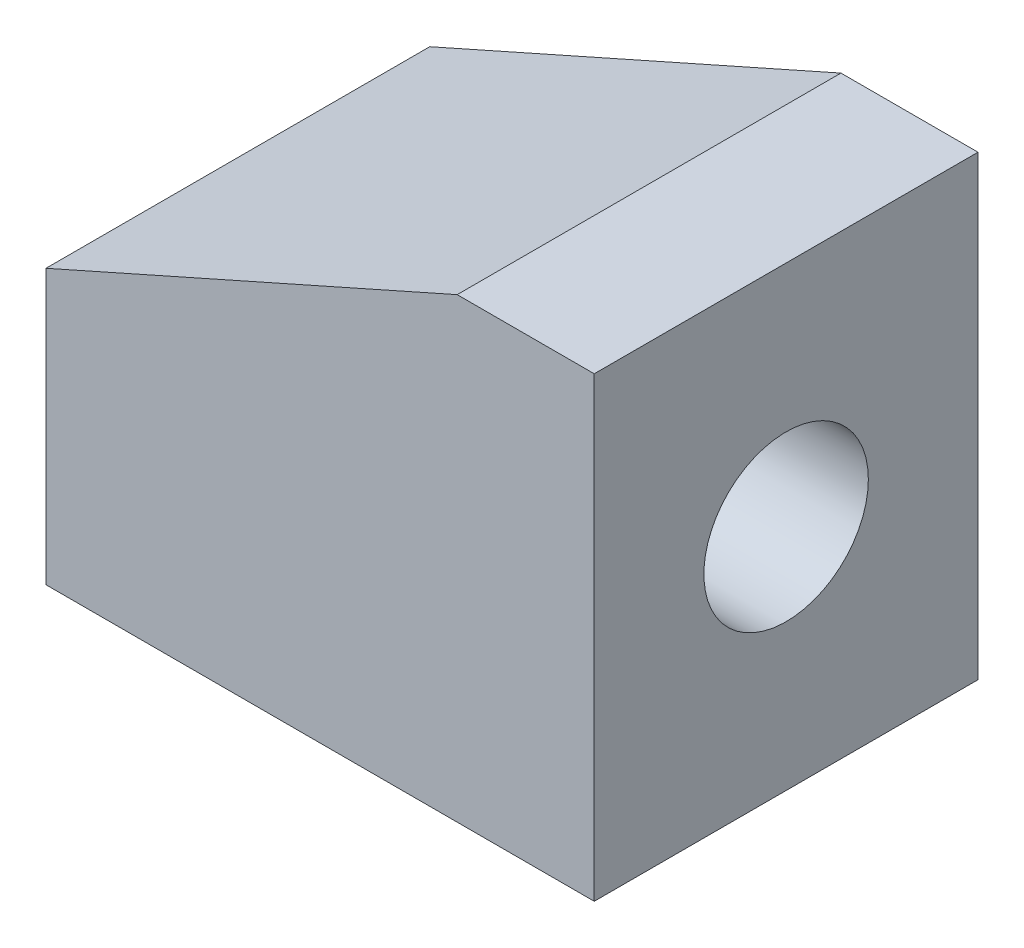
from build123d import *

# Parameters (mm, degrees)
BOSS_EXTRUDE1_DEPTH = 42
SKETCH2_R           = 9
CUT_EXTRUDE1_DEPTH  = 40


with BuildPart() as part:
    # Sketch1 → Boss-Extrude1 (new body)
    with BuildSketch(Plane.XY):
        Polygon((-30, 0), (30, 0), (30, 50), (15, 50), (-30, 30), align=None)
    extrude(amount=-BOSS_EXTRUDE1_DEPTH)

    # Sketch2 → Cut-Extrude1 (cut)
    with BuildSketch(Plane(origin=(30, 0, 0), x_dir=(0, 0, -1), z_dir=(1, 0, 0))):
        with Locations((21, 25)):
            Circle(SKETCH2_R)
    extrude(amount=-CUT_EXTRUDE1_DEPTH, mode=Mode.SUBTRACT)


solid = part.part
